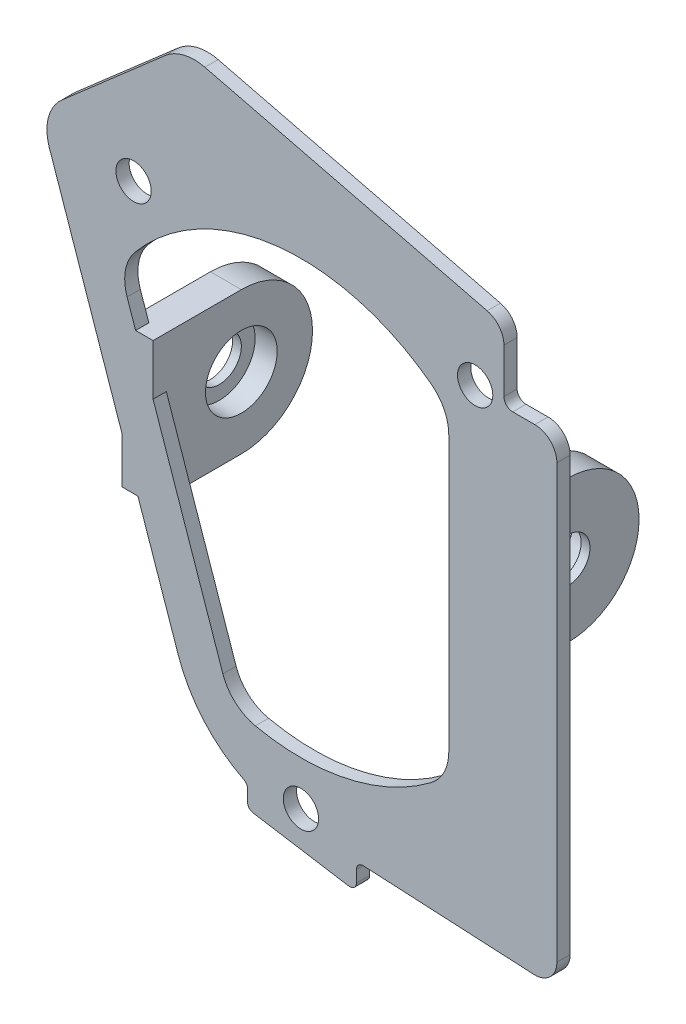
from build123d import *

# Parameters (mm, degrees)
SKETCH1_R                               = 4
BUMPER_LINK_DEPTH                       = 3
SKETCH3_R                               = 8.125
BEARING_BLOCK_DEPTH                     = 7
BEARING_START                           = -2
SKETCH4_R                               = 8.125
SKETCH4_R_2                             = 5
BEARING_END_FLANGE_DEPTH                = 2
MIRRORED_BEARING_BLOCK_CONNECTION_DEPTH = 3


with BuildPart() as part:
    # Sketch1 → Bumper link (new body)
    with BuildSketch(Plane.XY):
        with BuildLine():
            Line((-12.098962679, -61.104930733), (-12.098962679, -63.762456748))
            ThreePointArc((-12.098962679, -63.762456748), (-11.741328645, -64.734567853), (-10.838962679, -65.24313227))
            Line((-10.838962679, -65.24313227), (10.838962679, -68.75686773))
            ThreePointArc((10.838962679, -68.75686773), (12.051073784, -68.418558175), (12.578962679, -67.276192209))
            Line((12.578962679, -67.276192209), (12.578962679, -64.618666193))
            ThreePointArc((12.578962679, -64.618666193), (13.046119656, -63.530900001), (14.156609733, -63.12067723))
            Line((14.156609733, -63.12067723), (52.741176488, -65.12067723))
            ThreePointArc((52.741176488, -65.12067723), (56.442810076, -63.753267994), (58, -60.127380685))
            Line((58, -60.127380685), (58, 37.87932277))
            ThreePointArc((58, 37.87932277), (56.535533906, 41.414856676), (53, 42.87932277))
            Line((53, 42.87932277), (48, 42.87932277))
            ThreePointArc((48, 42.87932277), (46.585786438, 43.465109208), (46, 44.87932277))
            Line((46, 44.87932277), (46, 54.964915964))
            ThreePointArc((46, 54.964915964), (44.937003937, 58.047122965), (42.2, 59.818780404))
            Line((42.2, 59.818780404), (-21.754442807, 75.629961849))
            ThreePointArc((-21.754442807, 75.629961849), (-26.508147155, 75.641290323), (-30.729965317, 73.456322411))
            Line((-30.729965317, 73.456322411), (-54.135467109, 53.028717314))
            ThreePointArc((-54.135467109, 53.028717314), (-57.221318402, 48.074910074), (-57.01624643, 42.242189451))
            Line((-57.01624643, 42.242189451), (-27.78932032, -42.733634568))
            ThreePointArc((-27.78932032, -42.733634568), (-22.022249502, -52.703383692), (-12.923793734, -59.765473046))
            ThreePointArc((-12.923793734, -59.765473046), (-12.321709099, -60.318404642), (-12.098962679, -61.104930733))
        make_face()
        with Locations((0, -59)):
            Circle(SKETCH1_R, mode=Mode.SUBTRACT)
        with Locations((-37.924468972, 45.196622144)):
            Circle(SKETCH1_R, mode=Mode.SUBTRACT)
        with Locations((39.478705775, 43.845544703)):
            Circle(SKETCH1_R, mode=Mode.SUBTRACT)
        with BuildLine():
            Line((33.5, 31.124748995), (33.5, -31.124748995))
            ThreePointArc((33.5, -31.124748995), (32.451435925, -35.582528136), (29.525641026, -39.105453865))
            ThreePointArc((29.525641026, -39.105453865), (10.554762126, -47.849733505), (-10.33433455, -47.897823848))
            ThreePointArc((-10.33433455, -47.897823848), (-14.864224576, -45.601026517), (-17.681588514, -41.375196178))
            Line((-17.681588514, -41.375196178), (-39.391489139, 21.745252689))
            ThreePointArc((-39.391489139, 21.745252689), (-39.769582846, 26.810055426), (-37.610876362, 31.407355497))
            ThreePointArc((-37.610876362, 31.407355497), (-5.581929526, 48.681023641), (29.525641026, 39.105453865))
            ThreePointArc((29.525641026, 39.105453865), (32.451435925, 35.582528136), (33.5, 31.124748995))
        make_face(mode=Mode.SUBTRACT)
    extrude(amount=BUMPER_LINK_DEPTH)

    # Sketch3 → Bearing block (add)
    with BuildSketch(Plane.ZY.offset(-33.5)):
        with BuildLine():
            Line((-17, 16.125), (0, 16.125))
            Line((0, 16.125), (0, -16.125))
            Line((0, -16.125), (-17, -16.125))
            ThreePointArc((-17, -16.125), (-33.125, 0), (-17, 16.125))
        make_face()
        with Locations(Location((-17, 0, 0), (0, 0, 270))):
            Circle(SKETCH3_R, mode=Mode.SUBTRACT)
    bearing_block = extrude(amount=-BEARING_BLOCK_DEPTH)

    # Sketch4 → Bearing end flange (add)
    with BuildSketch(Plane(origin=(40.5, 0, 0), x_dir=(0, 0, -1), z_dir=(1, 0, 0)).offset(BEARING_START)):
        with Locations(Location((17, 0, 0), (0, 0, 270))):
            Circle(SKETCH4_R)
        with Locations(Location((17, 0, 0), (0, 0, 90))):
            Circle(SKETCH4_R_2, mode=Mode.SUBTRACT)
    bearing_end_flange = extrude(amount=BEARING_END_FLANGE_DEPTH)

    # Mirror1: Bearing block, Bearing end flange across plane
    add(bearing_block.mirror(Plane(origin=(0, 0, 0), x_dir=(0, 0, 1), z_dir=(1, 0, 0))))
    add(bearing_end_flange.mirror(Plane(origin=(0, 0, 0), x_dir=(0, 0, 1), z_dir=(1, 0, 0))))

    # Sketch6 → Mirrored bearing block connection (add)
    with BuildSketch(Plane.XY):
        Polygon((-37.458436863, 16.125), (-33.5, 4.616043054), (-33.5, 16.125), align=None)
        Polygon((-40.5, -16.125), (-36.941200933, -16.125), (-40.5, -5.777969932), align=None)
    extrude(amount=MIRRORED_BEARING_BLOCK_CONNECTION_DEPTH)


solid = part.part
